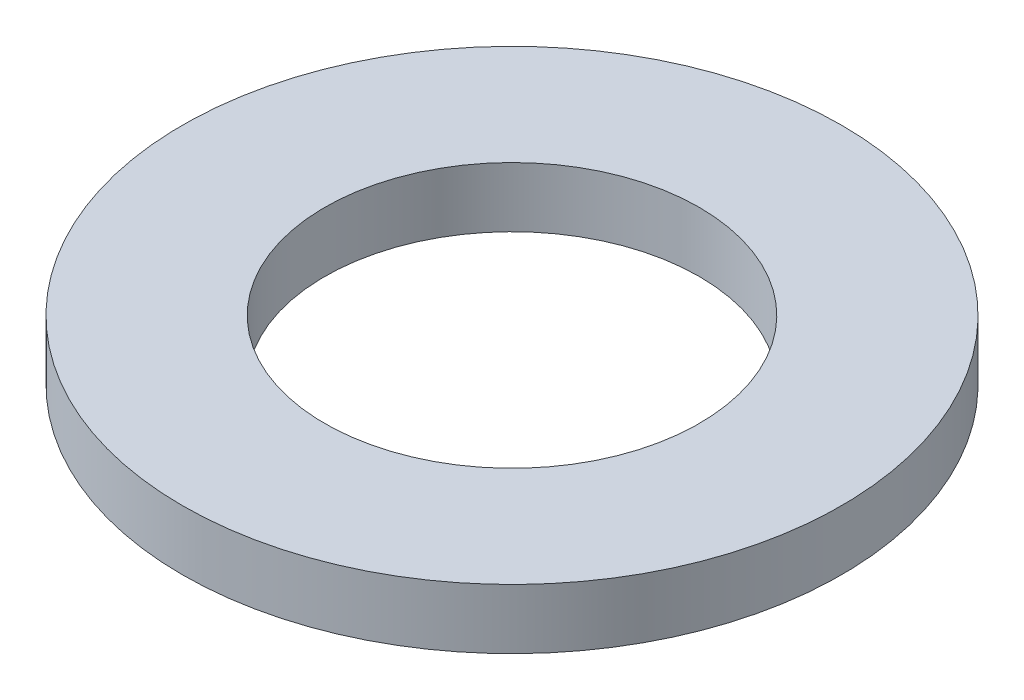
from build123d import *

# Parameters (mm, degrees)
SKETCH_1_W = 9.5
SKETCH_1_H = 4


with BuildPart() as part:
    # 草图1 → Revolve 469 (revolve)
    with BuildSketch(Plane.XY, mode=Mode.PRIVATE) as revolve_469_sk:
        with Locations((-17.25, 10.644507042)):
            Rectangle(SKETCH_1_W, SKETCH_1_H)
    revolve(revolve_469_sk.sketch.rotate(Axis((0, 0, 0), (0, 1, 0)), 270), axis=Axis((0, 0, 0), (0, 1, 0)))


solid = part.part
